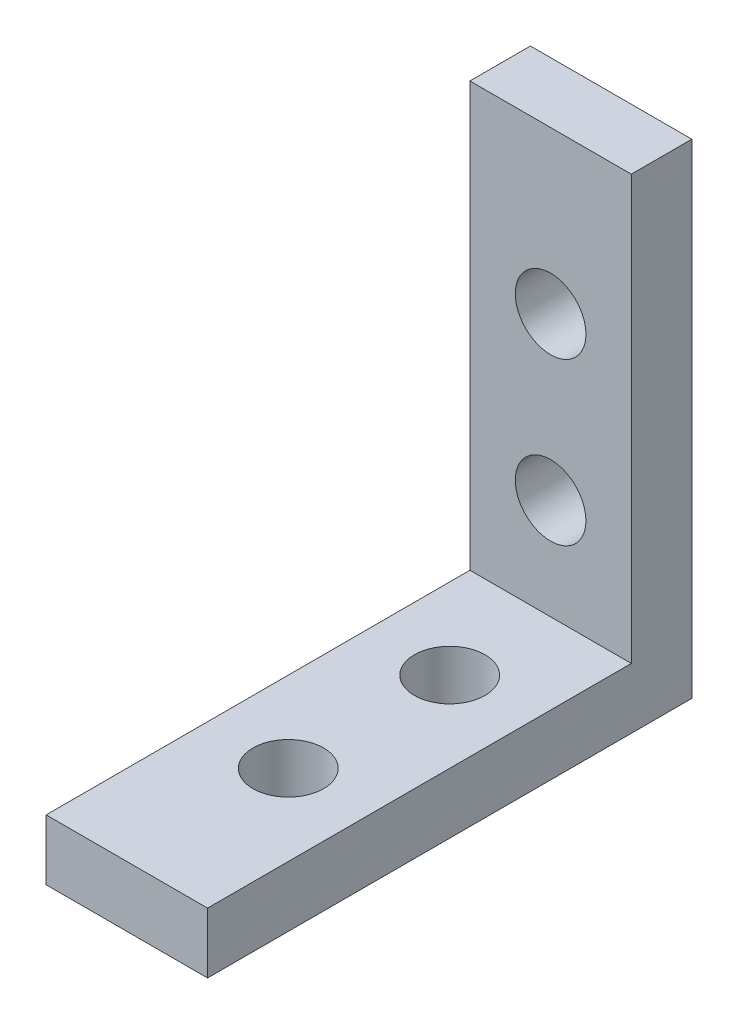
from build123d import *

# Parameters (mm, degrees)
SKETCH2_W           = 8
SKETCH2_H           = 24
BOSS_EXTRUDE1_DEPTH = 3
SKETCH3_W           = 8
SKETCH3_H           = 3
BOSS_EXTRUDE2_DEPTH = 21
SKETCH7_R           = 1.75
CUT_EXTRUDE3_DEPTH  = 10
SKETCH8_R           = 1.75
CUT_EXTRUDE4_DEPTH  = 10


with BuildPart() as part:
    # Sketch2 → Boss-Extrude1 (new body)
    with BuildSketch(Plane.XY):
        with Locations((-53.564966099, 16.294171637)):
            Rectangle(SKETCH2_W, SKETCH2_H)
    extrude(amount=BOSS_EXTRUDE1_DEPTH)

    # Sketch3 → Boss-Extrude2 (add)
    with BuildSketch(Plane.XY.offset(3)):
        with Locations((-53.564966099, 5.794171637)):
            Rectangle(SKETCH3_W, SKETCH3_H)
    extrude(amount=BOSS_EXTRUDE2_DEPTH)

    # Sketch7 → Cut-Extrude3 (cut)
    with BuildSketch(Plane(origin=(0, 0, 0), x_dir=(-1, 0, 0), z_dir=(0, 0, -1))):
        with Locations((53.564966099, 12.294171637)):
            Circle(SKETCH7_R)
        with Locations((53.564966099, 20.294171637)):
            Circle(SKETCH7_R)
    extrude(amount=-CUT_EXTRUDE3_DEPTH, mode=Mode.SUBTRACT)

    # Sketch8 → Cut-Extrude4 (cut)
    with BuildSketch(Plane.XZ.offset(-4.294171637)):
        with Locations(Location((-53.564966099, 8, 0), (0, 0, 270))):
            Circle(SKETCH8_R)
        with Locations(Location((-53.564966099, 16, 0), (0, 0, 270))):
            Circle(SKETCH8_R)
    extrude(amount=-CUT_EXTRUDE4_DEPTH, mode=Mode.SUBTRACT)


solid = part.part
